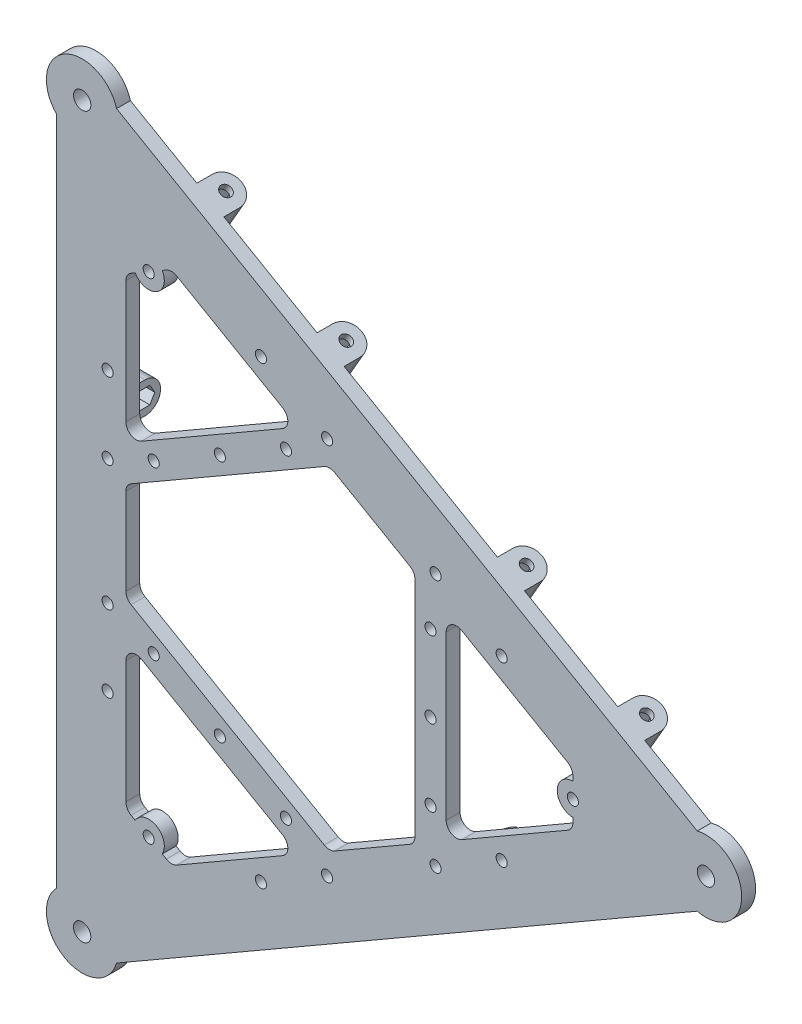
from build123d import *

# Parameters (mm, degrees)
SKETCH_1_R               = 1.6
SKETCH_1_R_2             = 2.5
EXTRUDE_1_DEPTH          = 4
SKETCH_2_R               = 1.6
EXTRUDE_2_DEPTH          = 8
SKETCH_2_4_R             = 1.6
EXTRUDE_3_DEPTH          = 17
CUT_EXTRUDE_1_DEPTH      = 18
PATTERN_CIRCULAR_1_COUNT = 3
PATTERN_CIRCULAR_2_COUNT = 3
PATTERN_CIRCULAR_3_COUNT = 3
FILLET_1_R               = 3


with BuildPart() as part:
    # 草图1 → 凸台-拉伸1 (new body)
    with BuildSketch(Plane.XY):
        with BuildLine():
            Line((-49.991869114, -106.58845727), (117.304246303, -10))
            ThreePointArc((117.304246303, -10), (130.112010367, 0), (117.304246303, 10))
            Line((117.304246303, 10), (-49.991869114, 106.58845727))
            ThreePointArc((-49.991869114, 106.58845727), (-65.056005183, 112.680306315), (-67.312377189, 96.58845727))
            Line((-67.312377189, 96.58845727), (-67.312377189, -96.58845727))
            ThreePointArc((-67.312377189, -96.58845727), (-65.056005183, -112.680306315), (-49.991869114, -106.58845727))
        make_face()
        with Locations((-8.398602374, -65.546806024)):
            Circle(SKETCH_1_R, mode=Mode.SUBTRACT)
        with Locations((-52.565897967, -40.046806024)):
            Circle(SKETCH_1_R, mode=Mode.SUBTRACT)
        with Locations((-52.565897967, -18.046806024)):
            Circle(SKETCH_1_R, mode=Mode.SUBTRACT)
        with Locations((10.653956509, -54.546806024)):
            Circle(SKETCH_1_R, mode=Mode.SUBTRACT)
        with Locations((41.911941457, -36.5)):
            Circle(SKETCH_1_R, mode=Mode.SUBTRACT)
        with Locations((60.964500341, -25.5)):
            Circle(SKETCH_1_R, mode=Mode.SUBTRACT)
        with Locations((-52.565897967, 18.046806024)):
            Circle(SKETCH_1_R, mode=Mode.SUBTRACT)
        with Locations((-52.565897967, 40.046806024)):
            Circle(SKETCH_1_R, mode=Mode.SUBTRACT)
        with BuildLine():
            Line((44.964500341, 28.671361037), (81.464500341, 7.598076211))
            Line((81.464500341, 7.598076211), (81.464500341, 4.5))
            ThreePointArc((81.464500341, 4.5), (76.964500341, 0), (81.464500341, -4.5))
            Line((81.464500341, -4.5), (81.464500341, -7.598076211))
            Line((81.464500341, -7.598076211), (44.964500341, -28.671361037))
            Line((44.964500341, -28.671361037), (44.964500341, 28.671361037))
        make_face(mode=Mode.SUBTRACT)
        Polygon((11.347876849, 48.079927659), (35.964500341, 33.867513459), (35.964500341, -33.867513459), (11.347876849, -48.079927659), (-47.312377189, -14.2124142), (-47.312377189, 14.2124142), align=None, mode=Mode.SUBTRACT)
        with BuildLine():
            Line((-34.152123151, 74.349364907), (2.347876849, 53.276080082))
            Line((2.347876849, 53.276080082), (-47.312377189, 24.604719045))
            Line((-47.312377189, 24.604719045), (-47.312377189, 66.751288696))
            Line((-47.312377189, 66.751288696), (-44.629364487, 68.300326802))
            ThreePointArc((-44.629364487, 68.300326802), (-38.48225017, 66.653212485), (-36.835135853, 72.800326802))
            Line((-36.835135853, 72.800326802), (-34.152123151, 74.349364907))
        make_face(mode=Mode.SUBTRACT)
        with BuildLine():
            Line((-47.312377189, -66.751288696), (-47.312377189, -24.604719045))
            Line((-47.312377189, -24.604719045), (2.347876849, -53.276080082))
            Line((2.347876849, -53.276080082), (-34.152123151, -74.349364907))
            Line((-34.152123151, -74.349364907), (-36.835135853, -72.800326802))
            ThreePointArc((-36.835135853, -72.800326802), (-38.48225017, -66.653212485), (-44.629364487, -68.300326802))
            Line((-44.629364487, -68.300326802), (-47.312377189, -66.751288696))
        make_face(mode=Mode.SUBTRACT)
        with Locations((10.653956509, 54.546806024)):
            Circle(SKETCH_1_R, mode=Mode.SUBTRACT)
        with Locations((-8.398602374, 65.546806024)):
            Circle(SKETCH_1_R, mode=Mode.SUBTRACT)
        with Locations((60.964500341, 25.5)):
            Circle(SKETCH_1_R, mode=Mode.SUBTRACT)
        with Locations((41.911941457, 36.5)):
            Circle(SKETCH_1_R, mode=Mode.SUBTRACT)
        with Locations((40.464500341, 0)):
            Circle(SKETCH_1_R, mode=Mode.SUBTRACT)
        with Locations((40.464500341, 22)):
            Circle(SKETCH_1_R, mode=Mode.SUBTRACT)
        with Locations((40.464500341, -22)):
            Circle(SKETCH_1_R, mode=Mode.SUBTRACT)
        with Locations((-20.23225017, 35.043285246)):
            Circle(SKETCH_1_R, mode=Mode.SUBTRACT)
        with Locations((-1.179691287, 46.043285246)):
            Circle(SKETCH_1_R, mode=Mode.SUBTRACT)
        with Locations((-39.284809054, 24.043285246)):
            Circle(SKETCH_1_R, mode=Mode.SUBTRACT)
        with Locations((-39.284809054, -24.043285246)):
            Circle(SKETCH_1_R, mode=Mode.SUBTRACT)
        with Locations((-1.179691287, -46.043285246)):
            Circle(SKETCH_1_R, mode=Mode.SUBTRACT)
        with Locations((-20.23225017, -35.043285246)):
            Circle(SKETCH_1_R, mode=Mode.SUBTRACT)
        with Locations((119.804246303, 0)):
            Circle(SKETCH_1_R_2, mode=Mode.SUBTRACT)
        with Locations((-59.902123151, -103.753520779)):
            Circle(SKETCH_1_R_2, mode=Mode.SUBTRACT)
        with Locations((-59.902123151, 103.753520779)):
            Circle(SKETCH_1_R_2, mode=Mode.SUBTRACT)
        with Locations((81.464500341, 0)):
            Circle(SKETCH_1_R, mode=Mode.SUBTRACT)
        with Locations((-40.73225017, 70.550326802)):
            Circle(SKETCH_1_R, mode=Mode.SUBTRACT)
        with Locations((-40.73225017, -70.550326802)):
            Circle(SKETCH_1_R, mode=Mode.SUBTRACT)
    extrude(amount=EXTRUDE_1_DEPTH)

    # 草图2 → 凸台-拉伸2 (add)
    # profile 1 of 2: a face of its own
    with BuildSketch(Plane(origin=(-67.312377189, 0, 0), x_dir=(0, 0, -1), z_dir=(1, 0, 0))):
        with BuildLine():
            Line((0, 74.5), (0, 65.5))
            Line((0, 65.5), (4.5, 65.5))
            ThreePointArc((4.5, 65.5), (9, 70), (4.5, 74.5))
            Line((4.5, 74.5), (0, 74.5))
        make_face()
        with Locations((4.5, 70)):
            Circle(SKETCH_2_R, mode=Mode.SUBTRACT)
    # profile 2 of 2: a face of its own
    with BuildSketch(Plane(origin=(-67.312377189, 0, 0), x_dir=(0, 0, -1), z_dir=(1, 0, 0))):
        with BuildLine():
            Line((4.5, -65.5), (0, -65.5))
            Line((0, -65.5), (0, -74.5))
            Line((0, -74.5), (4.5, -74.5))
            ThreePointArc((4.5, -74.5), (9, -70), (4.5, -65.5))
        make_face()
        with Locations((4.5, -70)):
            Circle(SKETCH_2_R, mode=Mode.SUBTRACT)
    extrude_2 = extrude(amount=EXTRUDE_2_DEPTH)

    # 草图2<4> → 凸台-拉伸3 (add)
    # profile 1 of 2: a face of its own
    with BuildSketch(Plane(origin=(-67.312377189, 0, 0), x_dir=(0, 0, -1), z_dir=(1, 0, 0))):
        with BuildLine():
            Line((4.5, -25.5), (0, -25.5))
            Line((0, -25.5), (0, -34.5))
            Line((0, -34.5), (4.5, -34.5))
            ThreePointArc((4.5, -34.5), (9, -30), (4.5, -25.5))
        make_face()
        with Locations((4.5, -30)):
            Circle(SKETCH_2_4_R, mode=Mode.SUBTRACT)
    # profile 2 of 2: a face of its own
    with BuildSketch(Plane(origin=(-67.312377189, 0, 0), x_dir=(0, 0, -1), z_dir=(1, 0, 0))):
        with BuildLine():
            Line((4.5, 34.5), (0, 34.5))
            Line((0, 34.5), (0, 25.5))
            Line((0, 25.5), (4.5, 25.5))
            ThreePointArc((4.5, 25.5), (9, 30), (4.5, 34.5))
        make_face()
        with Locations((4.5, 30)):
            Circle(SKETCH_2_4_R, mode=Mode.SUBTRACT)
    extrude_3 = extrude(amount=EXTRUDE_3_DEPTH)

    # 草图4 → 切除-拉伸1 (cut)
    with BuildSketch(Plane(origin=(-47.312377189, 0, 0), x_dir=(0, 0, -1), z_dir=(1, 0, 0))):
        Polygon((1.670983681, 70), (3.08549184, 67.55), (5.91450816, 67.55), (7.329016319, 70), (5.91450816, 72.45), (3.08549184, 72.45), align=None)
        Polygon((7.329016319, 30), (5.91450816, 32.45), (3.08549184, 32.45), (1.670983681, 30), (3.08549184, 27.55), (5.91450816, 27.55), align=None)
        Polygon((7.329016319, -30), (5.91450816, -27.55), (3.08549184, -27.55), (1.670983681, -30), (3.08549184, -32.45), (5.91450816, -32.45), align=None)
        Polygon((7.329016319, -70), (5.91450816, -67.55), (3.08549184, -67.55), (1.670983681, -70), (3.08549184, -72.45), (5.91450816, -72.45), align=None)
    cut_extrude_1 = extrude(amount=-CUT_EXTRUDE_1_DEPTH, mode=Mode.SUBTRACT)

    # 阵列(圆周)1: 凸台-拉伸3 ×3 about axis
    pattern_circular_1_axis = Axis((0, 0, 0), (0, 0, -1))
    for i in range(1, PATTERN_CIRCULAR_1_COUNT):
        add(extrude_3.rotate(pattern_circular_1_axis, i * 360 / PATTERN_CIRCULAR_1_COUNT))

    # 阵列(圆周)2: 凸台-拉伸2 ×3 about axis
    pattern_circular_2_axis = Axis((0, 0, 0), (0, 0, -1))
    for i in range(1, PATTERN_CIRCULAR_2_COUNT):
        add(extrude_2.rotate(pattern_circular_2_axis, i * 360 / PATTERN_CIRCULAR_2_COUNT))

    # 阵列(圆周)3: 切除-拉伸1 ×3 about axis
    pattern_circular_3_axis = Axis((0, 0, 0), (0, 0, -1))
    for i in range(1, PATTERN_CIRCULAR_3_COUNT):
        add(cut_extrude_1.rotate(pattern_circular_3_axis, i * 360 / PATTERN_CIRCULAR_3_COUNT), mode=Mode.SUBTRACT)

    # 圆角1
    fillet_1_edges = [part.edges().sort_by_distance(p)[0] for p in [
        (35.964500341, -33.867513459, 2),
        (11.347876849, -48.079927659, 2),
        (-47.312377189, -14.2124142, 2),
        (-47.312377189, 14.2124142, 2),
        (35.964500341, 33.867513459, 2),
        (11.347876849, 48.079927659, 2),
        (-47.312377189, -24.604719045, 2),
        (-47.312377189, -66.751288696, 2),
        (-34.152123151, -74.349364907, 2),
        (2.347876849, -53.276080082, 2),
        (44.964500341, -28.671361037, 2),
        (81.464500341, -7.598076211, 2),
        (81.464500341, 7.598076211, 2),
        (44.964500341, 28.671361037, 2),
        (-34.152123151, 74.349364907, 2),
        (-47.312377189, 66.751288696, 2),
        (-47.312377189, 24.604719045, 2),
        (2.347876849, 53.276080082, 2),
    ]]
    fillet(fillet_1_edges, radius=FILLET_1_R)


solid = part.part
